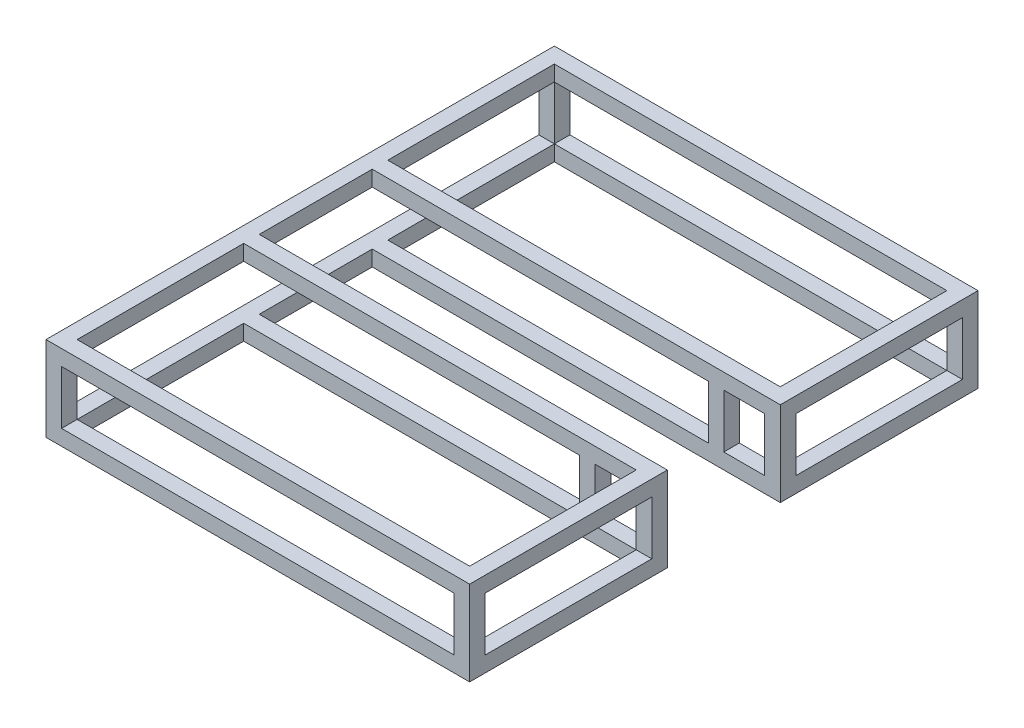
from build123d import *

# Parameters (mm, degrees)
SKETCH1_W               = 381
SKETCH1_H               = 76.2
BOSS_EXTRUDE1_DEPTH     = 14
SKETCH2_W               = 353.0000052
SKETCH2_H               = 48.2
CUT_EXTRUDE1_DEPTH      = 14
SKETCH5_W               = 381
SKETCH5_H               = 13.97
BOSS_EXTRUDE2_DEPTH     = 76.2
SKETCH6_W               = 353.0000052
SKETCH6_H               = 48.2
CUT_EXTRUDE2_DEPTH      = 76.2
SKETCH3_W               = 13.9999974
SKETCH3_H               = 14
BOSS_EXTRUDE3_DEPTH     = 429.26
SKETCH7_W               = 13.9999974
SKETCH7_H               = 101.6
CUT_EXTRUDE3_DEPTH      = 429.26
SKETCH10_W              = 13.9999974
SKETCH10_H              = 13.97
BOSS_EXTRUDE4_DEPTH     = 48.26
SKETCH11_W              = 353.0000052
SKETCH11_H              = 13.97
BOSS_EXTRUDE5_DEPTH     = 76.2
CUT_EXTRUDE4_DEPTH      = 352.863349754
CUT_EXTRUDE4_DEPTH_BACK = 352.863349754
SKETCH12_W              = 353.0000052
SKETCH12_H              = 48.2
SKETCH13_W              = 13.97
SKETCH13_H              = 13.97
BOSS_EXTRUDE6_DEPTH     = 48.26


with BuildPart() as part:
    # Sketch1 → Boss-Extrude1 (new body)
    with BuildSketch(Plane.XY):
        Rectangle(SKETCH1_W, SKETCH1_H)
    extrude(amount=BOSS_EXTRUDE1_DEPTH)

    # Sketch2 → Cut-Extrude1 (cut)
    with BuildSketch(Plane.XY.offset(14)):
        Rectangle(SKETCH2_W, SKETCH2_H)
    extrude(amount=-CUT_EXTRUDE1_DEPTH, mode=Mode.SUBTRACT)



with BuildPart() as body_2:
    # Sketch5 → Boss-Extrude2 (new body)
    with BuildSketch(Plane(origin=(0, -38.1, 0), x_dir=(1, 0, 0), z_dir=(0, 1, 0))):
        with Locations((0, -450.215)):
            Rectangle(SKETCH5_W, SKETCH5_H)
    extrude(amount=BOSS_EXTRUDE2_DEPTH)

    # Sketch6 → Cut-Extrude2 (cut)
    with BuildSketch(Plane(origin=(0, 0, 443.23), x_dir=(-1, 0, 0), z_dir=(0, 0, -1))):
        Rectangle(SKETCH6_W, SKETCH6_H)
    extrude(amount=-CUT_EXTRUDE2_DEPTH, mode=Mode.SUBTRACT)


with BuildPart() as part_1:
    add(part.part)

    add(body_2.part)  # Boss-Extrude3 merges body 2
    # Sketch3 → Boss-Extrude3 (add)
    with BuildSketch(Plane.XY.offset(14)):
        with Locations((-183.5000013, -31.1)):
            Rectangle(SKETCH3_W, SKETCH3_H)
        with Locations((-183.5000013, 31.1)):
            Rectangle(SKETCH3_W, SKETCH3_H)
        with Locations((183.5000013, -31.1)):
            Rectangle(SKETCH3_W, SKETCH3_H)
        with Locations((183.5000013, 31.1)):
            Rectangle(SKETCH3_W, SKETCH3_H)
    extrude(amount=BOSS_EXTRUDE3_DEPTH)

    # Sketch7 → Cut-Extrude3 (cut)
    with BuildSketch(Plane(origin=(0, 38.1, 0), x_dir=(1, 0, 0), z_dir=(0, 1, 0))):
        with Locations((183.5000013, -228.6)):
            Rectangle(SKETCH7_W, SKETCH7_H)
    extrude(amount=-CUT_EXTRUDE3_DEPTH, mode=Mode.SUBTRACT)

    # Sketch10 → Boss-Extrude4 (add)
    with BuildSketch(Plane(origin=(0, -24.1, 0), x_dir=(1, 0, 0), z_dir=(0, 1, 0))):
        with Locations((183.5000013, -170.815)):
            Rectangle(SKETCH10_W, SKETCH10_H)
        with Locations((183.5000013, -286.415)):
            Rectangle(SKETCH10_W, SKETCH10_H)
    extrude(amount=BOSS_EXTRUDE4_DEPTH)

    # Sketch11 → Boss-Extrude5 (add)
    with BuildSketch(Plane(origin=(0, -38.1, 0), x_dir=(1, 0, 0), z_dir=(0, 1, 0))):
        with Locations((0, -170.815)):
            Rectangle(SKETCH11_W, SKETCH11_H)
        with Locations((0, -286.415)):
            Rectangle(SKETCH11_W, SKETCH11_H)
    extrude(amount=BOSS_EXTRUDE5_DEPTH)

    # Sketch12 → Cut-Extrude4 (cut, two sides: drawn at the far end of the back side and taken through both)
    with BuildSketch(Plane(origin=(0, 0, 163.83), x_dir=(-1, 0, 0), z_dir=(0, 0, -1)).offset(-CUT_EXTRUDE4_DEPTH_BACK)):
        Rectangle(SKETCH12_W, SKETCH12_H)
    extrude(amount=CUT_EXTRUDE4_DEPTH + CUT_EXTRUDE4_DEPTH_BACK, mode=Mode.SUBTRACT)

    # Sketch13 → Boss-Extrude6 (add)
    with BuildSketch(Plane(origin=(0, -24.1, 0), x_dir=(1, 0, 0), z_dir=(0, 1, 0))):
        with Locations((132.6850026, -286.415)):
            Rectangle(SKETCH13_W, SKETCH13_H)
        with Locations((132.6850026, -170.815)):
            Rectangle(SKETCH13_W, SKETCH13_H)
    extrude(amount=BOSS_EXTRUDE6_DEPTH)


solid = part_1.part
